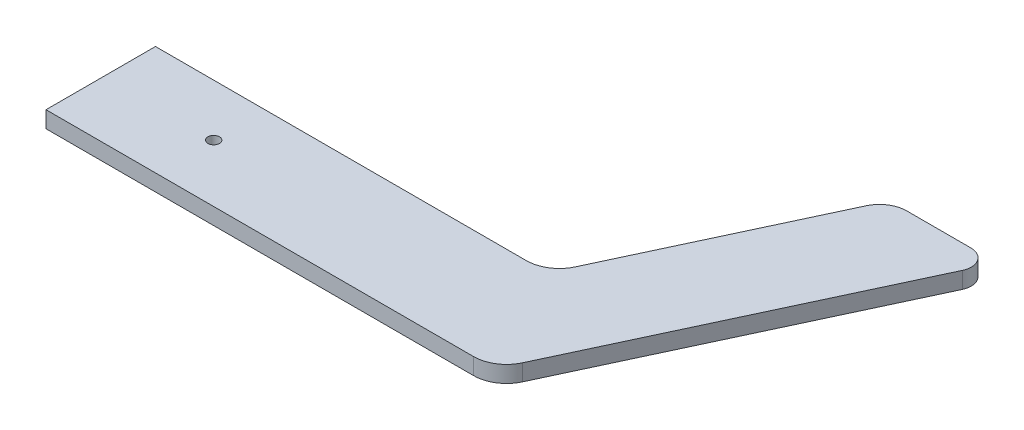
from build123d import *

# Parameters (mm, degrees)
ESBO_O1_R                = 1.05
RESSALTO_EXTRUS_O1_DEPTH = 3


with BuildPart() as part:
    # Esboço1 → Ressalto-extrusão1 (new body)
    with BuildSketch(Plane(origin=(0, 0, 0), x_dir=(1, 0, 0), z_dir=(0, 1, 0))):
        with BuildLine():
            Line((-65, 19.865476825), (-65, 0))
            Line((-65, 0), (0, 0))
            Line((0, 0), (12.574875441, 0))
            ThreePointArc((12.574875441, 0), (15.798673091, 0.939651325), (18.012722163, 3.46429043))
            Line((18.012722163, 3.46429043), (43.410601428, 57.93021828))
            ThreePointArc((43.410601428, 57.93021828), (43.221852405, 60.80997189), (40.691678067, 62.198073065))
            Line((40.691678067, 62.198073065), (29.011685815, 62.198073065))
            ThreePointArc((29.011685815, 62.198073065), (26.348436448, 61.421806665), (24.519362347, 59.336147382))
            Line((24.519362347, 59.336147382), (7.729311551, 23.329767255))
            ThreePointArc((7.729311551, 23.329767255), (5.515262479, 20.80512815), (2.291464829, 19.865476825))
            Line((2.291464829, 19.865476825), (-65, 19.865476825))
        make_face()
        with Locations(Location((-45, 10.43351307, 0), (0, 0, 270))):
            Circle(ESBO_O1_R, mode=Mode.SUBTRACT)
    extrude(amount=RESSALTO_EXTRUS_O1_DEPTH)


solid = part.part
